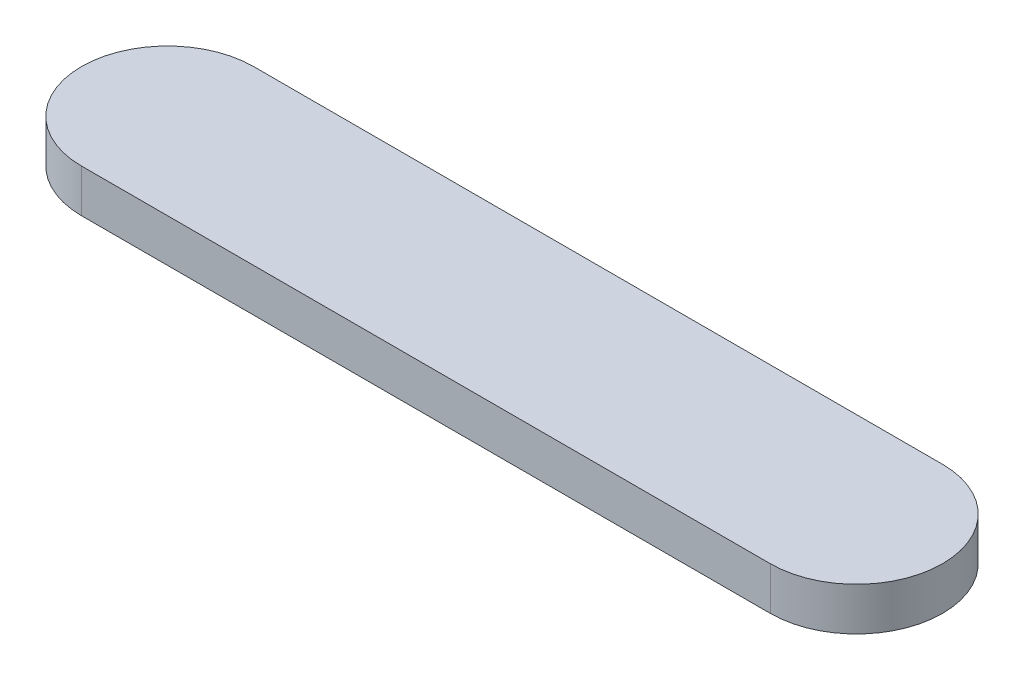
from build123d import *

# Parameters (mm, degrees)
EXTRUDE_1_DEPTH = 25


with BuildPart() as part:
    # 草图1 → 凸台-拉伸1 (new body)
    with BuildSketch(Plane(origin=(0, 0, 0), x_dir=(1, 0, 0), z_dir=(0, 1, 0))):
        with BuildLine():
            Line((-200, 50), (200, 50))
            ThreePointArc((200, 50), (250, 0), (200, -50))
            Line((200, -50), (-200, -50))
            ThreePointArc((-200, -50), (-250, 0), (-200, 50))
        make_face()
    extrude(amount=EXTRUDE_1_DEPTH)


solid = part.part
